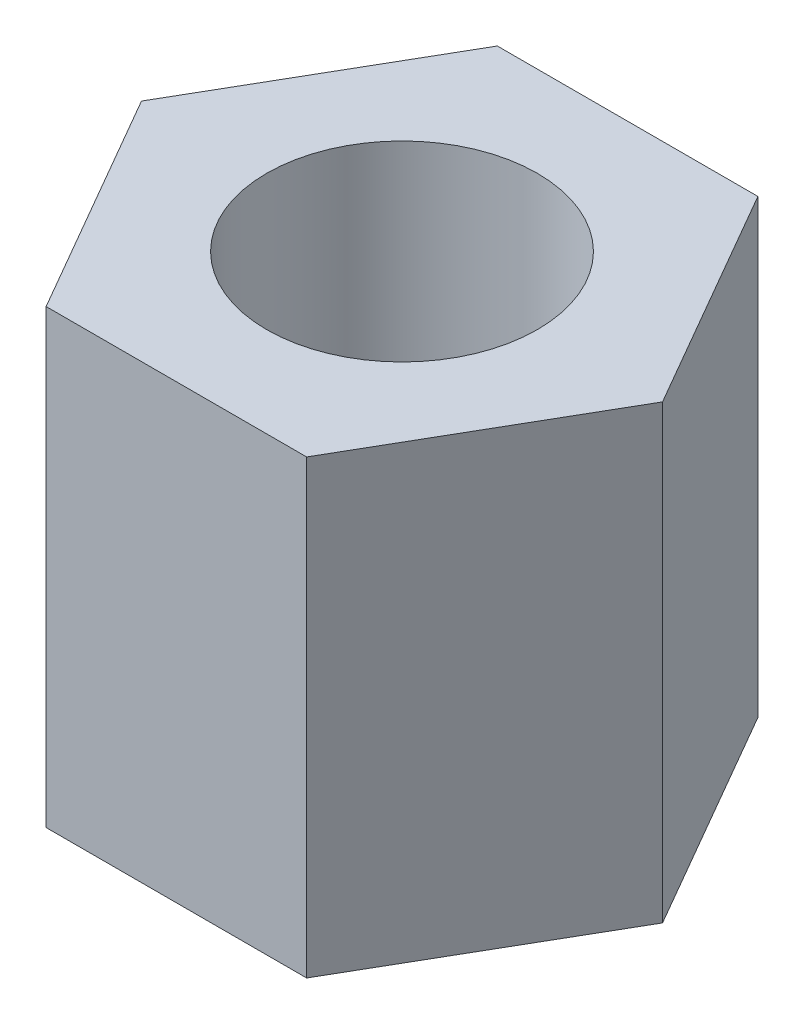
from build123d import *

# Parameters (mm, degrees)
ESQUISSE1_R      = 1.5
EXTRUSION1_DEPTH = 5


with BuildPart() as part:
    # Esquisse1 → Extrusion1 (new body)
    with BuildSketch(Plane(origin=(0, 0, 0), x_dir=(1, 0, 0), z_dir=(0, 1, 0))):
        Polygon((2.886751346, 0), (1.443375673, 2.5), (-1.443375673, 2.5), (-2.886751346, 0), (-1.443375673, -2.5), (1.443375673, -2.5), align=None)
        with Locations(Location((0, 0, 0), (0, 0, 270))):
            Circle(ESQUISSE1_R, mode=Mode.SUBTRACT)
    extrude(amount=EXTRUSION1_DEPTH)


solid = part.part
